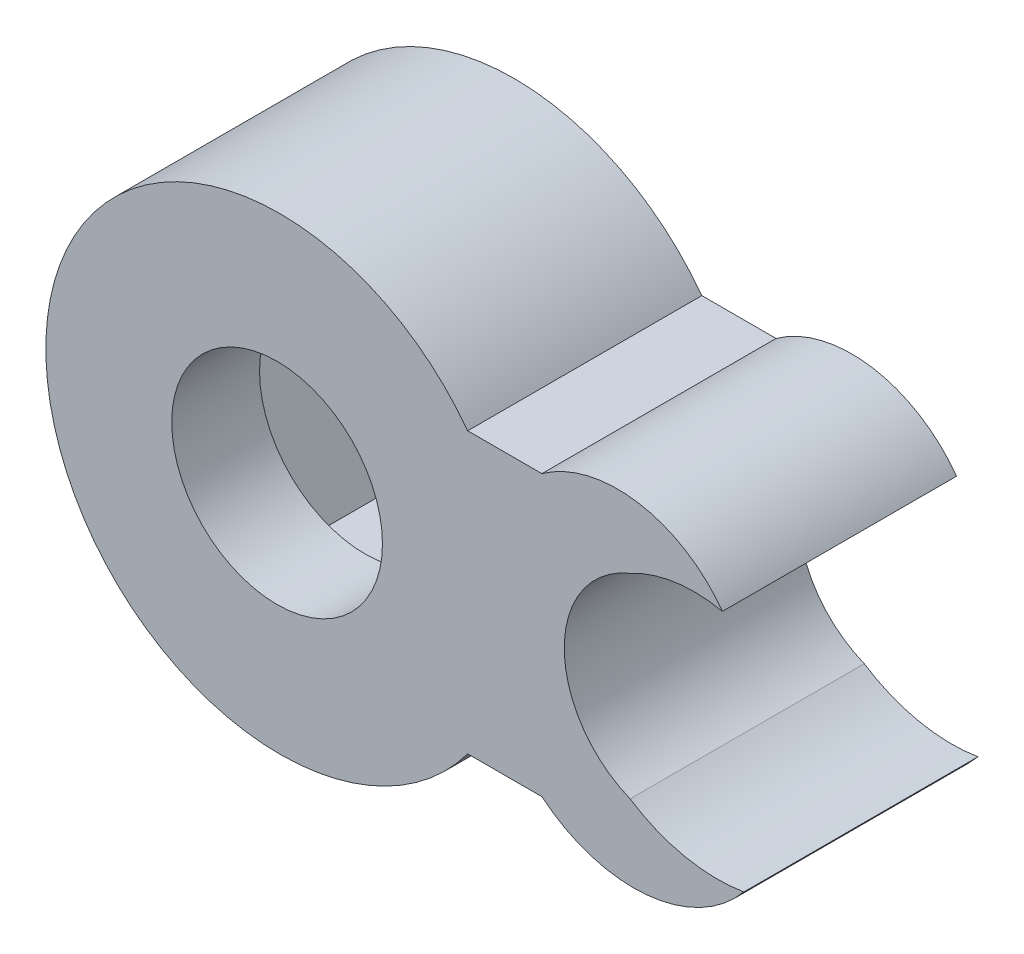
from build123d import *

# Parameters (mm, degrees)
ESQUISSE1_W             = 3.17
ESQUISSE1_H             = 11.950083308
BOSS_EXTRU_1_DEPTH      = 10
ESQUISSE3_R             = 4.5
ENL_V_MAT_EXTRU_1_DEPTH = 6.25
ESQUISSE4_R             = 4.5
ENL_V_MAT_EXTRU_2_DEPTH = 10
ENL_V_MAT_EXTRU_4_DEPTH = 10
BOSS_EXTRU_3_DEPTH      = 10
BOSS_EXTRU_4_DEPTH      = 10


with BuildPart() as part:
    # Esquisse1 → Boss.-Extru.1 (new body)
    with BuildSketch(Plane.XY):
        with Locations((1.585, 5.975041654)):
            Rectangle(ESQUISSE1_W, ESQUISSE1_H)
        with BuildLine():
            ThreePointArc((0, 0), (-18.018658069, 5.975041654), (0, 11.950083308))
            Line((0, 11.950083308), (0, 0))
        make_face()
        with BuildLine():
            ThreePointArc((3.17, 11.950083308), (8.623303343, 5.975041654), (3.17, 0))
            Line((3.17, 0), (3.17, 11.950083308))
        make_face()
    extrude(amount=BOSS_EXTRU_1_DEPTH)

    # Esquisse3 → Enlèv. mat.-Extru.1 (cut)
    with BuildSketch(Plane.XY):
        with Locations((8.623303343, 5.975041654)):
            Circle(ESQUISSE3_R)
        Polygon((-4.326089499, -0.75758567), (-0.341747487, 5.806586179), (-4.034316058, 12.539213503), (-11.71122664, 12.707668978), (-15.695568652, 6.143497129), (-12.003000081, -0.589130195), align=None)
    extrude(amount=ENL_V_MAT_EXTRU_1_DEPTH, mode=Mode.SUBTRACT)

    # Esquisse4 → Enlèv. mat.-Extru.2 (cut)
    with BuildSketch(Plane(origin=(0, 0, 6.25), x_dir=(-1, 0, 0), z_dir=(0, 0, -1))):
        with Locations((8.141028583, 5.951350622)):
            Circle(ESQUISSE4_R)
    extrude(amount=-ENL_V_MAT_EXTRU_2_DEPTH, mode=Mode.SUBTRACT)

    # Esquisse6 → Enlèv. mat.-Extru.4 (cut)
    with BuildSketch(Plane(origin=(0, 0, 6.25), x_dir=(-1, 0, 0), z_dir=(0, 0, -1))):
        with BuildLine():
            ThreePointArc((-6.935803343, 1.803430005), (-8.623303343, 5.975041654), (-6.935803343, 10.146653303))
            ThreePointArc((-6.935803343, 10.146653303), (-4.123303343, 5.975041654), (-6.935803343, 1.803430005))
        make_face()
    extrude(amount=-ENL_V_MAT_EXTRU_4_DEPTH, mode=Mode.SUBTRACT)

    # Esquisse7 → Boss.-Extru.3 (add)
    with BuildSketch(Plane(origin=(0, 0, 0), x_dir=(-1, 0, 0), z_dir=(0, 0, -1))):
        with BuildLine():
            ThreePointArc((-3.17, 0), (-7.646039968, -1.391747442), (-11.795192237, 0.789176718))
            ThreePointArc((-11.795192237, 0.789176718), (-9.270284793, 0.840128378), (-6.935803343, 1.803430005))
            ThreePointArc((-6.935803343, 1.803430005), (-5.214835319, 0.563575862), (-3.17, 0))
        make_face()
    extrude(amount=-BOSS_EXTRU_3_DEPTH)

    # Esquisse8 → Boss.-Extru.4 (add)
    with BuildSketch(Plane(origin=(0, 0, 0), x_dir=(-1, 0, 0), z_dir=(0, 0, -1))):
        with BuildLine():
            ThreePointArc((-3.17, 11.950083308), (-7.281636762, 12.926912072), (-10.879725241, 10.71026808))
            ThreePointArc((-10.879725241, 10.71026808), (-8.857814072, 10.77798979), (-6.935803343, 10.146653303))
            ThreePointArc((-6.935803343, 10.146653303), (-5.214835319, 11.386507446), (-3.17, 11.950083308))
        make_face()
    extrude(amount=-BOSS_EXTRU_4_DEPTH)


solid = part.part
